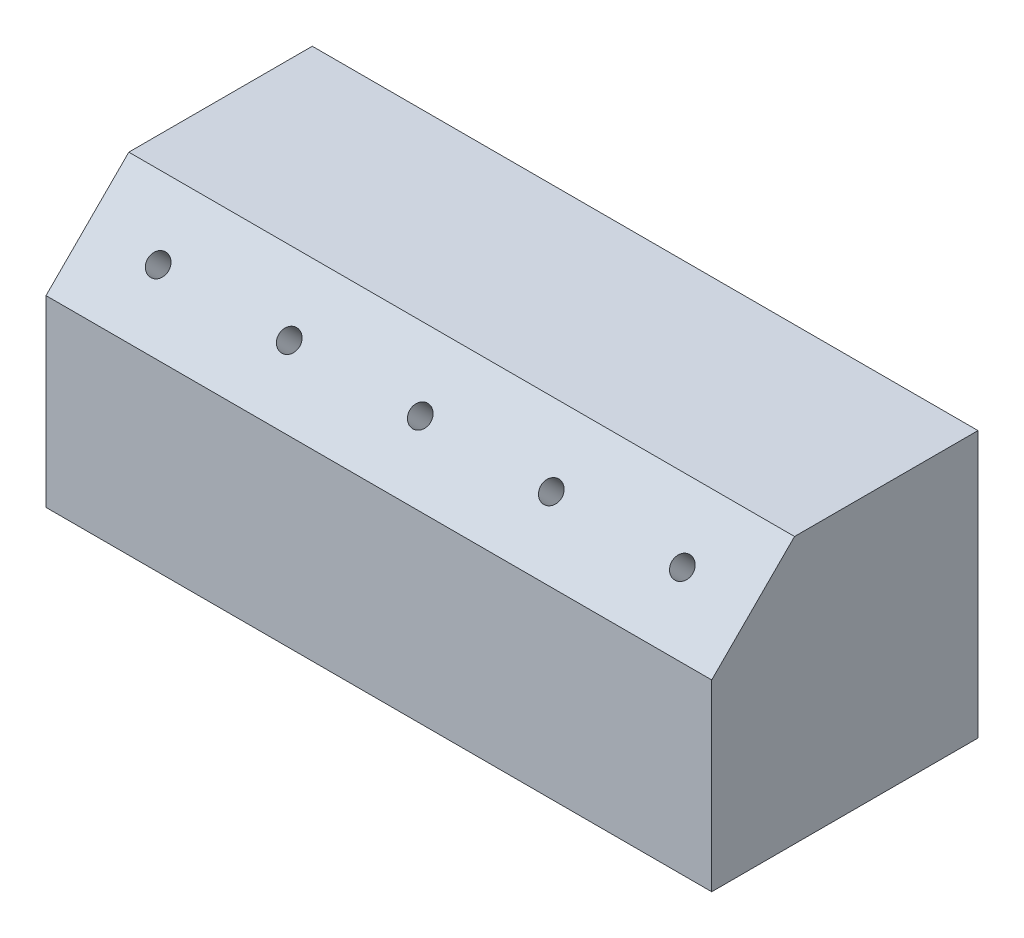
from build123d import *

# Parameters (mm, degrees)
SALIENTE_EXTRUIR1_DEPTH    = 63.5
CORTAR_EXTRUIR1_DEPTH      = 57
CORTAR_EXTRUIR1_DEPTH_BACK = 42
CROQUIS6_R                 = 5
CORTAR_EXTRUIR2_REACH      = 89.824
CORTAR_EXTRUIR2_END_RADIUS = 5
CROQUIS7_R                 = 2


with BuildPart() as part:
    # Croquis1 → Saliente-Extruir1 (new, symmetric)
    with BuildSketch(Plane(origin=(0, 0, 0), x_dir=(0, 0, -1), z_dir=(1, 0, 0))):
        Polygon((-9.6, 25.4), (-25.4, 9.6), (-25.4, -25.4), (25.4, -25.4), (25.4, 25.4), align=None)
    extrude(amount=SALIENTE_EXTRUIR1_DEPTH, both=True)

    # Croquis5 → Taladro roscado 1/4 NPT2 (revolve, cut)
    with BuildSketch(Plane(origin=(-63.5, 0, 0), x_dir=(0, 0, 1), z_dir=(0, 1, 0))):
        Polygon((0, 0), (0, 23.342347279), (5.5626, 20), (5.5626, 10.02), (6.557975082, 10.02), (6.8579873, 0), align=None)
    revolve(axis=Axis((-69.85, 0, 0), (1, 0, 0)), mode=Mode.SUBTRACT)

    # Croquis6 → Cortar-Extruir1 (cut, two sides: drawn at the far end of the back side and taken through both)
    with BuildSketch(Plane(origin=(0, 0, 0), x_dir=(0, 0, -1), z_dir=(1, 0, 0)).offset(-CORTAR_EXTRUIR1_DEPTH_BACK)):
        Circle(CROQUIS6_R)
    extrude(amount=CORTAR_EXTRUIR1_DEPTH + CORTAR_EXTRUIR1_DEPTH_BACK, mode=Mode.SUBTRACT)

    # Cortar-Extruir2: up to this cylinder (the profile starts outside it)
    cortar_extruir2_end = Plane(origin=(0, 0, 0), z_dir=(-1, 0, 0)) * Cylinder(CORTAR_EXTRUIR2_END_RADIUS, 290.648, mode=Mode.PRIVATE)
    # Croquis7 → Cortar-Extruir2 (cut, up to the surface)
    with BuildSketch(Plane(origin=(0, 17.5, 17.5), x_dir=(1, 0, 0), z_dir=(0, 0.7071067811865479, 0.7071067811865472)), mode=Mode.PRIVATE) as cortar_extruir2_sk1:
        with Locations(Location((0, 0, 0), (0, 0, 270))):
            Circle(CROQUIS7_R)
    cortar_extruir2_tool1 = extrude(cortar_extruir2_sk1.sketch, amount=-CORTAR_EXTRUIR2_REACH, mode=Mode.PRIVATE) - cortar_extruir2_end
    add(cortar_extruir2_tool1.solids().sort_by_distance((0, 17.5, 17.5))[0], mode=Mode.SUBTRACT)
    # Croquis7 → Cortar-Extruir2 (cut, up to the surface)
    with BuildSketch(Plane(origin=(0, 17.5, 17.5), x_dir=(1, 0, 0), z_dir=(0, 0.7071067811865479, 0.7071067811865472)), mode=Mode.PRIVATE) as cortar_extruir2_sk2:
        with Locations(Location((25, 0, 0), (0, 0, 270))):
            Circle(CROQUIS7_R)
    cortar_extruir2_tool2 = extrude(cortar_extruir2_sk2.sketch, amount=-CORTAR_EXTRUIR2_REACH, mode=Mode.PRIVATE) - cortar_extruir2_end
    add(cortar_extruir2_tool2.solids().sort_by_distance((25, 17.5, 17.5))[0], mode=Mode.SUBTRACT)
    # Croquis7 → Cortar-Extruir2 (cut, up to the surface)
    with BuildSketch(Plane(origin=(0, 17.5, 17.5), x_dir=(1, 0, 0), z_dir=(0, 0.7071067811865479, 0.7071067811865472)), mode=Mode.PRIVATE) as cortar_extruir2_sk3:
        with Locations(Location((50, 0, 0), (0, 0, 270))):
            Circle(CROQUIS7_R)
    cortar_extruir2_tool3 = extrude(cortar_extruir2_sk3.sketch, amount=-CORTAR_EXTRUIR2_REACH, mode=Mode.PRIVATE) - cortar_extruir2_end
    add(cortar_extruir2_tool3.solids().sort_by_distance((50, 17.5, 17.5))[0], mode=Mode.SUBTRACT)
    # Croquis7 → Cortar-Extruir2 (cut, up to the surface)
    with BuildSketch(Plane(origin=(0, 17.5, 17.5), x_dir=(1, 0, 0), z_dir=(0, 0.7071067811865479, 0.7071067811865472)), mode=Mode.PRIVATE) as cortar_extruir2_sk4:
        with Locations(Location((-50, 0, 0), (0, 0, 270))):
            Circle(CROQUIS7_R)
    cortar_extruir2_tool4 = extrude(cortar_extruir2_sk4.sketch, amount=-CORTAR_EXTRUIR2_REACH, mode=Mode.PRIVATE) - cortar_extruir2_end
    add(cortar_extruir2_tool4.solids().sort_by_distance((-50, 17.5, 17.5))[0], mode=Mode.SUBTRACT)
    # Croquis7 → Cortar-Extruir2 (cut, up to the surface)
    with BuildSketch(Plane(origin=(0, 17.5, 17.5), x_dir=(1, 0, 0), z_dir=(0, 0.7071067811865479, 0.7071067811865472)), mode=Mode.PRIVATE) as cortar_extruir2_sk5:
        with Locations(Location((-25, 0, 0), (0, 0, 270))):
            Circle(CROQUIS7_R)
    cortar_extruir2_tool5 = extrude(cortar_extruir2_sk5.sketch, amount=-CORTAR_EXTRUIR2_REACH, mode=Mode.PRIVATE) - cortar_extruir2_end
    add(cortar_extruir2_tool5.solids().sort_by_distance((-25, 17.5, 17.5))[0], mode=Mode.SUBTRACT)


solid = part.part
